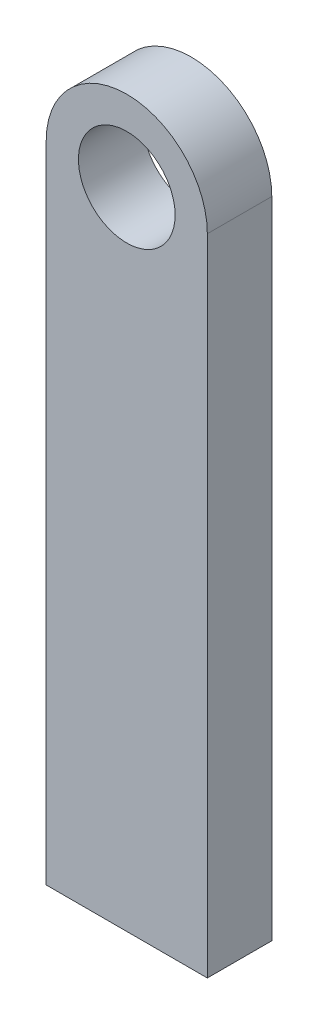
from build123d import *

# Parameters (mm, degrees)
SKETCH1_R           = 1.5
BOSS_EXTRUDE1_DEPTH = 2


with BuildPart() as part:
    # Sketch1 → Boss-Extrude1 (new body)
    with BuildSketch(Plane.XY):
        with BuildLine():
            Line((-2.5, 0), (-2.5, -20))
            Line((-2.5, -20), (2.5, -20))
            Line((2.5, -20), (2.5, 0))
            ThreePointArc((2.5, 0), (0, 2.5), (-2.5, 0))
        make_face()
        Circle(SKETCH1_R, mode=Mode.SUBTRACT)
    extrude(amount=BOSS_EXTRUDE1_DEPTH)


solid = part.part
